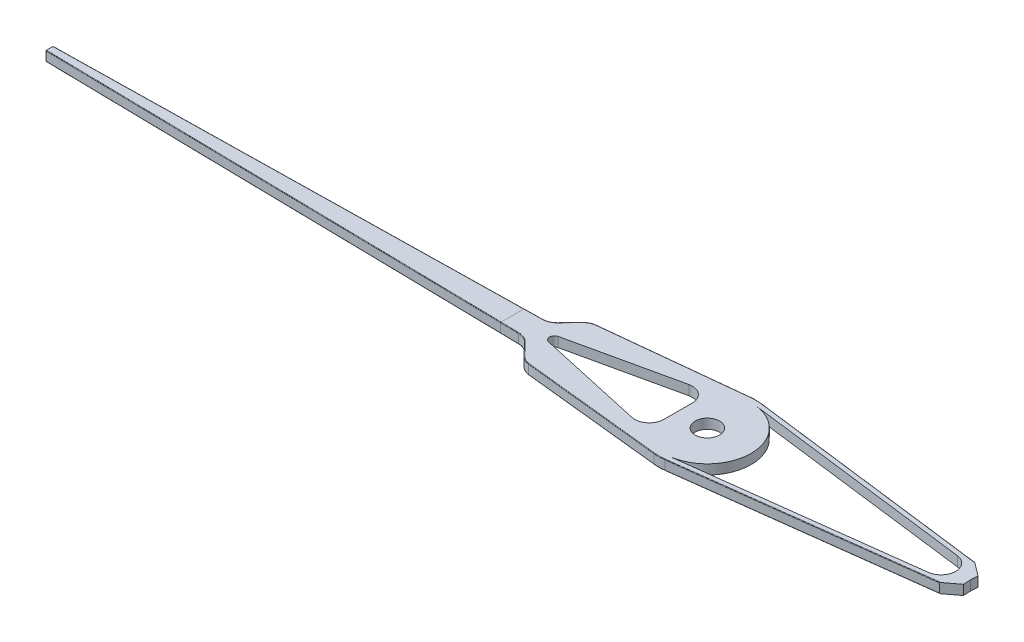
from build123d import *

# Parameters (mm, degrees)
BOSS_EXTRUDE1_DEPTH = 0.1
SKETCH2_R           = 0.25
CUT_EXTRUDE1_DEPTH  = 14.538463724
FILLET1_R           = 0.01


with BuildPart() as part:
    # Sketch1 → Boss-Extrude1 (new, symmetric)
    with BuildSketch(Plane(origin=(0, 0, 0), x_dir=(1, 0, 0), z_dir=(0, 1, 0))):
        with BuildLine():
            Line((-13.5, -0.075), (-13.5, 0.075))
            Line((-13.5, 0.075), (-3.624245143, 0.247381942))
            ThreePointArc((-3.624245143, 0.247381942), (-3.509856144, 0.272218228), (-3.413678925, 0.33893874))
            Line((-3.413678925, 0.33893874), (-3.158737497, 0.602938316))
            ThreePointArc((-3.158737497, 0.602938316), (-3.074446901, 0.664179018), (-2.974294096, 0.692897373))
            Line((-2.974294096, 0.692897373), (-0.104528463, 0.994521895))
            ThreePointArc((-0.104528463, 0.994521895), (0.010357122, 0.999946364), (0.125105703, 0.992143419))
            Line((0.125105703, 0.992143419), (5.126889803, 0.361436503))
            Line((5.126889803, 0.361436503), (5.405723796, 0.149890754))
            Line((5.405723796, 0.149890754), (5.4, 0))
            Line((5.4, 0), (5.405723796, -0.149890754))
            Line((5.405723796, -0.149890754), (5.126889803, -0.361436503))
            Line((5.126889803, -0.361436503), (0.125105703, -0.992143419))
            ThreePointArc((0.125105703, -0.992143419), (0.010357122, -0.999946364), (-0.104528463, -0.994521895))
            Line((-0.104528463, -0.994521895), (-2.974294096, -0.692897373))
            ThreePointArc((-2.974294096, -0.692897373), (-3.074446901, -0.664179018), (-3.158737497, -0.602938316))
            Line((-3.158737497, -0.602938316), (-3.413678925, -0.33893874))
            ThreePointArc((-3.413678925, -0.33893874), (-3.509856144, -0.272218228), (-3.624245143, -0.247381942))
            Line((-3.624245143, -0.247381942), (-13.5, -0.075))
        make_face()
        with BuildLine():
            Line((-3.15962133, 0.097629601), (-0.964931884, 0.584180537))
            ThreePointArc((-0.964931884, 0.584180537), (-0.712222958, 0.52525708), (-0.6, 0.291291735))
            Line((-0.6, 0.291291735), (-0.6, -0.291291735))
            ThreePointArc((-0.6, -0.291291735), (-0.712222958, -0.52525708), (-0.964931884, -0.584180537))
            Line((-0.964931884, -0.584180537), (-3.15962133, -0.097629601))
            ThreePointArc((-3.15962133, -0.097629601), (-3.237977368, 0), (-3.15962133, 0.097629601))
        make_face(mode=Mode.SUBTRACT)
        with BuildLine():
            Line((0.114136342, 0.892733384), (4.833465433, 0.297643026))
            ThreePointArc((4.833465433, 0.297643026), (5.095933723, 0), (4.833465433, -0.297643026))
            Line((4.833465433, -0.297643026), (0.114136342, -0.892733384))
            ThreePointArc((0.114136342, -0.892733384), (0.9, 0), (0.114136342, 0.892733384))
        make_face(mode=Mode.SUBTRACT)
    extrude(amount=BOSS_EXTRUDE1_DEPTH, both=True)

    # Sketch2 → Cut-Extrude1 (cut, through all)
    with BuildSketch(Plane(origin=(0, 0.1, 0), x_dir=(1, 0, 0), z_dir=(0, 1, 0))):
        with Locations(Location((0, 0, 0), (0, 0, 270))):
            Circle(SKETCH2_R)
    extrude(amount=-CUT_EXTRUDE1_DEPTH, mode=Mode.SUBTRACT)

    # Fillet1
    fillet1_edges = [part.edges().sort_by_distance(p)[0] for p in [
        (2.625997753, 0.1, -0.676789961),
        (0.010357122, 0.1, -0.999946364),
        (2.625997753, -0.1, 0.676789961),
        (0.010357122, -0.1, 0.999946364),
        (-1.53941128, -0.1, 0.843709634),
        (-3.074446901, -0.1, 0.664179018),
        (-3.286208211, -0.1, 0.470938528),
        (-3.509856144, -0.1, 0.272218228),
        (-1.53941128, 0.1, -0.843709634),
        (-8.562122571, -0.1, 0.161190971),
        (-8.562122571, -0.1, -0.161190971),
        (-3.509856144, -0.1, -0.272218228),
        (-3.286208211, -0.1, -0.470938528),
        (-3.074446901, -0.1, -0.664179018),
        (-1.53941128, -0.1, -0.843709634),
        (-3.074446901, 0.1, -0.664179018),
        (0.010357122, -0.1, -0.999946364),
        (2.625997753, -0.1, -0.676789961),
        (-3.286208211, 0.1, -0.470938528),
        (-3.509856144, 0.1, -0.272218228),
        (-13.5, 0, -0.075),
        (-8.562122571, 0.1, -0.161190971),
        (-8.562122571, 0.1, 0.161190971),
        (-3.509856144, 0.1, 0.272218228),
        (-3.286208211, 0.1, 0.470938528),
        (-3.074446901, 0.1, 0.664179018),
        (-1.53941128, 0.1, 0.843709634),
        (0.010357122, 0.1, 0.999946364),
        (2.625997753, 0.1, 0.676789961),
    ]]
    fillet(fillet1_edges, radius=FILLET1_R)


solid = part.part
